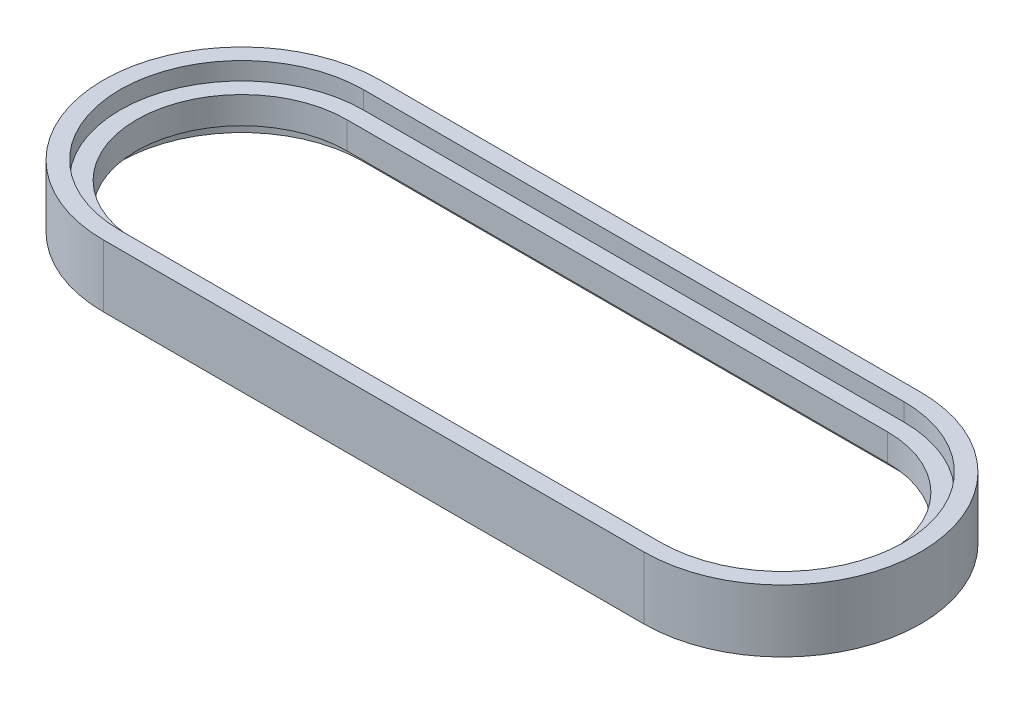
from build123d import *

# Parameters (mm, degrees)
BOSS_EXTRUDE1_DEPTH      = 30
BOSS_EXTRUDE2_DEPTH      = 6.5
BOSS_EXTRUDE2_DEPTH_BACK = 6.5


with BuildPart() as part:
    # Sketch1 → Boss-Extrude1 (new body)
    with BuildSketch(Plane(origin=(0, 0, 0), x_dir=(1, 0, 0), z_dir=(0, 1, 0))):
        with BuildLine():
            Line((0, 66.57), (260, 66.57))
            ThreePointArc((260, 66.57), (326.57, 0), (260, -66.57))
            Line((260, -66.57), (0, -66.57))
            ThreePointArc((0, -66.57), (-66.57, 0), (0, 66.57))
        make_face()
        with BuildLine():
            Line((0, 58.57), (260, 58.57))
            ThreePointArc((260, 58.57), (318.57, 0), (260, -58.57))
            Line((260, -58.57), (0, -58.57))
            ThreePointArc((0, -58.57), (-58.57, 0), (0, 58.57))
        make_face(mode=Mode.SUBTRACT)
    extrude(amount=BOSS_EXTRUDE1_DEPTH)

    # Sketch2 → Boss-Extrude2 (add, two sides: drawn at the far end of the back side and taken through both)
    with BuildSketch(Plane(origin=(0, 15, 0), x_dir=(-1, 0, 0), z_dir=(0, -1, 0)).offset(-BOSS_EXTRUDE2_DEPTH_BACK)):
        with BuildLine():
            Line((0, -58.57), (-260, -58.57))
            ThreePointArc((-260, -58.57), (-318.57, 0), (-260, 58.57))
            Line((-260, 58.57), (0, 58.57))
            ThreePointArc((0, 58.57), (58.57, 0), (0, -58.57))
        make_face()
        with BuildLine():
            Line((0, -50.57), (-260, -50.57))
            ThreePointArc((-260, -50.57), (-310.57, 0), (-260, 50.57))
            Line((-260, 50.57), (0, 50.57))
            ThreePointArc((0, 50.57), (50.57, 0), (0, -50.57))
        make_face(mode=Mode.SUBTRACT)
    extrude(amount=BOSS_EXTRUDE2_DEPTH + BOSS_EXTRUDE2_DEPTH_BACK)


solid = part.part
